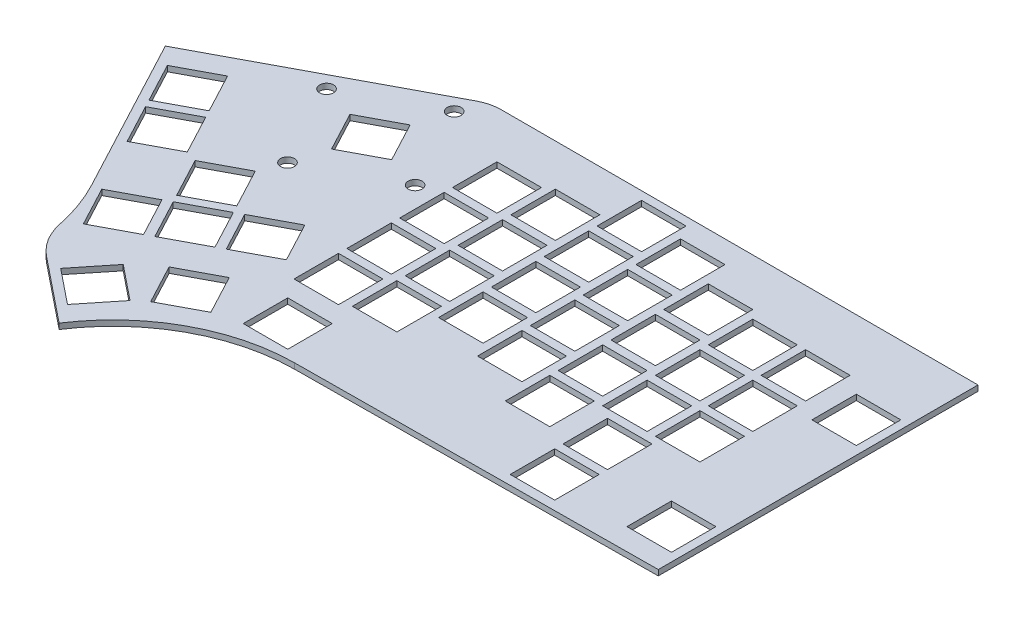
from build123d import *

# Parameters (mm, degrees)
SKETCH3_R   = 2.5
SKETCH3_W   = 16
SKETCH3_H   = 16
LASER_DEPTH = 2


with BuildPart() as part:
    # Sketch3 → Laser (new body)
    with BuildSketch(Plane(origin=(0, 0, 0), x_dir=(1, 0, 0), z_dir=(0, 1, 0))):
        with BuildLine():
            Line((-94.691051343, -6.582969065), (-21.663792567, 32.211956563))
            ThreePointArc((-21.663792567, 32.211956563), (-18.18495221, 33.546260198), (-14.486734177, 34))
            Line((-14.486734177, 34), (157, 34))
            Line((157, 34), (157, -80.984375239))
            Line((157, -80.984375239), (27.245097002, -82.002060753))
            ThreePointArc((27.245097002, -82.002060753), (-3.897107576, -90.097611519), (-27.500192145, -111.966979298))
            Line((-27.500192145, -111.966979298), (-50.631086639, -93.38167756))
            ThreePointArc((-50.631086639, -93.38167756), (-55.49562639, -87.852512852), (-58.20502519, -81.004552024))
            ThreePointArc((-58.20502519, -81.004552024), (-60.798796423, -71.823881458), (-64.66560314, -63.102633435))
            Line((-64.66560314, -63.102633435), (-94.691051343, -6.582969065))
        make_face()
        with Locations(Location((-22.393572022, 24.996840478, 0), (0, 0, 270))):
            Circle(SKETCH3_R, mode=Mode.SUBTRACT)
        with Locations(Location((-6.470173498, -4.977237981, 0), (0, 0, 270))):
            Circle(SKETCH3_R, mode=Mode.SUBTRACT)
        with Locations(Location((-36.444251957, -20.900636504, 0), (0, 0, 270))):
            Circle(SKETCH3_R, mode=Mode.SUBTRACT)
        with Locations(Location((-52.367650481, 9.073441955, 0), (0, 0, 270))):
            Circle(SKETCH3_R, mode=Mode.SUBTRACT)
        with Locations((9, -10)):
            Rectangle(SKETCH3_W, SKETCH3_H, mode=Mode.SUBTRACT)
        with Locations((9, 9)):
            Rectangle(SKETCH3_W, SKETCH3_H, mode=Mode.SUBTRACT)
        with Locations((28, 11)):
            Rectangle(SKETCH3_W, SKETCH3_H, mode=Mode.SUBTRACT)
        with Locations((47, 23)):
            Rectangle(SKETCH3_W, SKETCH3_H, mode=Mode.SUBTRACT)
        with Locations((66, 18)):
            Rectangle(SKETCH3_W, SKETCH3_H, mode=Mode.SUBTRACT)
        with Locations((85, 9)):
            Rectangle(SKETCH3_W, SKETCH3_H, mode=Mode.SUBTRACT)
        with Locations((104, 6)):
            Rectangle(SKETCH3_W, SKETCH3_H, mode=Mode.SUBTRACT)
        with Locations((123, 6)):
            Rectangle(SKETCH3_W, SKETCH3_H, mode=Mode.SUBTRACT)
        with Locations((146, 1.25)):
            Rectangle(SKETCH3_W, SKETCH3_H, mode=Mode.SUBTRACT)
        with Locations((146, -65.25)):
            Rectangle(SKETCH3_W, SKETCH3_H, mode=Mode.SUBTRACT)
        with Locations((28, -8)):
            Rectangle(SKETCH3_W, SKETCH3_H, mode=Mode.SUBTRACT)
        with Locations((47, 4)):
            Rectangle(SKETCH3_W, SKETCH3_H, mode=Mode.SUBTRACT)
        with Locations((66, -1)):
            Rectangle(SKETCH3_W, SKETCH3_H, mode=Mode.SUBTRACT)
        with Locations((85, -10)):
            Rectangle(SKETCH3_W, SKETCH3_H, mode=Mode.SUBTRACT)
        with Locations((104, -13)):
            Rectangle(SKETCH3_W, SKETCH3_H, mode=Mode.SUBTRACT)
        with Locations((123, -13)):
            Rectangle(SKETCH3_W, SKETCH3_H, mode=Mode.SUBTRACT)
        with Locations((9, -29)):
            Rectangle(SKETCH3_W, SKETCH3_H, mode=Mode.SUBTRACT)
        with Locations((28, -27)):
            Rectangle(SKETCH3_W, SKETCH3_H, mode=Mode.SUBTRACT)
        with Locations((47, -15)):
            Rectangle(SKETCH3_W, SKETCH3_H, mode=Mode.SUBTRACT)
        with Locations((66, -20)):
            Rectangle(SKETCH3_W, SKETCH3_H, mode=Mode.SUBTRACT)
        with Locations((85, -29)):
            Rectangle(SKETCH3_W, SKETCH3_H, mode=Mode.SUBTRACT)
        with Locations((104, -32)):
            Rectangle(SKETCH3_W, SKETCH3_H, mode=Mode.SUBTRACT)
        with Locations((123, -32)):
            Rectangle(SKETCH3_W, SKETCH3_H, mode=Mode.SUBTRACT)
        with Locations((9, -48)):
            Rectangle(SKETCH3_W, SKETCH3_H, mode=Mode.SUBTRACT)
        with Locations((28, -46)):
            Rectangle(SKETCH3_W, SKETCH3_H, mode=Mode.SUBTRACT)
        with Locations((47, -34)):
            Rectangle(SKETCH3_W, SKETCH3_H, mode=Mode.SUBTRACT)
        with Locations((66, -39)):
            Rectangle(SKETCH3_W, SKETCH3_H, mode=Mode.SUBTRACT)
        with Locations((85, -48)):
            Rectangle(SKETCH3_W, SKETCH3_H, mode=Mode.SUBTRACT)
        Polygon((-88.288511049, -12.240484229), (-74.158594957, -4.734122178), (-66.652232907, -18.86403827), (-80.782148999, -26.370400321), align=None, mode=Mode.SUBTRACT)
        with Locations((13.75, -71)):
            Rectangle(SKETCH3_W, SKETCH3_H, mode=Mode.SUBTRACT)
        with Locations((108.75, -51)):
            Rectangle(SKETCH3_W, SKETCH3_H, mode=Mode.SUBTRACT)
        with Locations((108.75, -70)):
            Rectangle(SKETCH3_W, SKETCH3_H, mode=Mode.SUBTRACT)
        Polygon((-65.244790023, -21.513397538), (-79.374706115, -29.019759588), (-71.868344064, -43.14967568), (-57.738427972, -35.64331363), align=None, mode=Mode.SUBTRACT)
        Polygon((-53.68162582, -36.885230013), (-39.551709728, -29.378867962), (-32.045347678, -43.508784054), (-46.17526377, -51.015146105), align=None, mode=Mode.SUBTRACT)
        Polygon((-27.988545526, -44.750700437), (-13.858629434, -37.244338387), (-6.352267384, -51.374254479), (-20.482183476, -58.880616529), align=None, mode=Mode.SUBTRACT)
        Polygon((-30.637904794, -46.158143322), (-44.767820886, -53.664505372), (-37.261458835, -67.794421464), (-23.131542743, -60.288059414), align=None, mode=Mode.SUBTRACT)
        Polygon((-47.417180153, -55.071948256), (-61.547096245, -62.578310307), (-54.040734195, -76.708226399), (-39.910818103, -69.201864348), align=None, mode=Mode.SUBTRACT)
        Polygon((-34.248075282, -82.171885463), (-44.269669774, -94.644561352), (-31.796993885, -104.666155844), (-21.775399393, -92.193479955), align=None, mode=Mode.SUBTRACT)
        Polygon((-25.21699676, -74.701037634), (-11.087080668, -67.194675584), (-3.580718618, -81.324591676), (-17.71063471, -88.830953726), align=None, mode=Mode.SUBTRACT)
        Polygon((-40.237051061, 5.359879008), (-26.107134969, 12.866241058), (-18.600772918, -1.263675034), (-32.73068901, -8.770037084), align=None, mode=Mode.SUBTRACT)
    extrude(amount=-LASER_DEPTH)


solid = part.part
